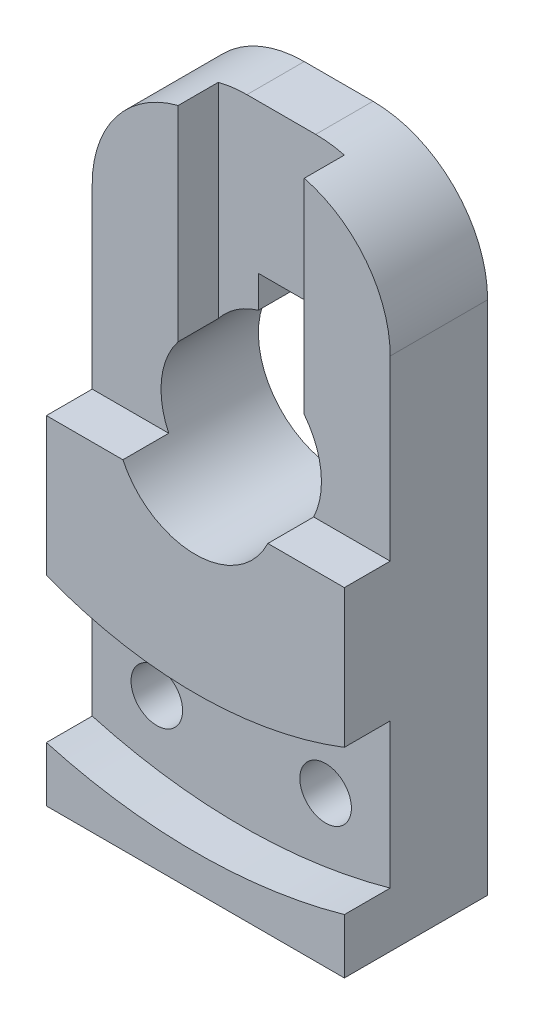
from build123d import *

# Parameters (mm, degrees)
SKETCH1_R               = 4.5
BOSS_EXTRUDE1_DEPTH     = 12.5
CUT_EXTRUDE1_DEPTH      = 114.720051002
CUT_EXTRUDE1_DEPTH_BACK = 51
CUT_EXTRUDE2_DEPTH      = 8


with BuildPart() as part:
    # Sketch1 → Boss-Extrude1 (new, symmetric)
    with BuildSketch(Plane(origin=(0, 0, 0), x_dir=(0, 1, 0), z_dir=(0, 0, 1))):
        with BuildLine():
            Line((0, 26), (0, 0))
            Line((0, 0), (0, -26))
            Line((0, -26), (90, -26))
            ThreePointArc((90, -26), (104.142135624, -20.142135624), (110, -6))
            Line((110, -6), (110, 6))
            ThreePointArc((110, 6), (104.142135624, 20.142135624), (90, 26))
            Line((90, 26), (0, 26))
        make_face()
        with Locations(Location((18.285849122, -14.728915195, 0), (0, 0, 270))):
            Circle(SKETCH1_R, mode=Mode.SUBTRACT)
        with BuildLine():
            ThreePointArc((78.416407865, -4), (51, 0), (78.416407865, 4))
            Line((78.416407865, 4), (84, 4))
            Line((84, 4), (84, -4))
            Line((84, -4), (78.416407865, -4))
        make_face(mode=Mode.SUBTRACT)
        with Locations(Location((18.285849122, 14.728915195, 0), (0, 0, 270))):
            Circle(SKETCH1_R, mode=Mode.SUBTRACT)
    extrude(amount=BOSS_EXTRUDE1_DEPTH, both=True)

    # Sketch2 → Cut-Extrude1 (cut, two sides: drawn at the far end of the back side and taken through both)
    with BuildSketch(Plane(origin=(0, 110, 0), x_dir=(-1, 0, 0), z_dir=(0, 1, 0)).offset(-CUT_EXTRUDE1_DEPTH_BACK)):
        Polygon((-26, 12.5), (-26, 4.5), (-11, 4.5), (-11, -2.5), (11, -2.5), (11, 4.5), (26, 4.5), (26, 12.5), align=None)
    extrude(amount=CUT_EXTRUDE1_DEPTH + CUT_EXTRUDE1_DEPTH_BACK, mode=Mode.SUBTRACT)

    # Sketch3 → Cut-Extrude2 (cut)
    with BuildSketch(Plane.XY.offset(12.5)):
        with BuildLine():
            Line((-26, 9.587879583), (-26, 34.858358674))
            ThreePointArc((-26, 34.858358674), (0, 30), (26, 34.858358674))
            Line((26, 34.858358674), (26, 9.587879583))
            ThreePointArc((26, 9.587879583), (0, 6), (-26, 9.587879583))
        make_face()
    extrude(amount=-CUT_EXTRUDE2_DEPTH, mode=Mode.SUBTRACT)


solid = part.part
